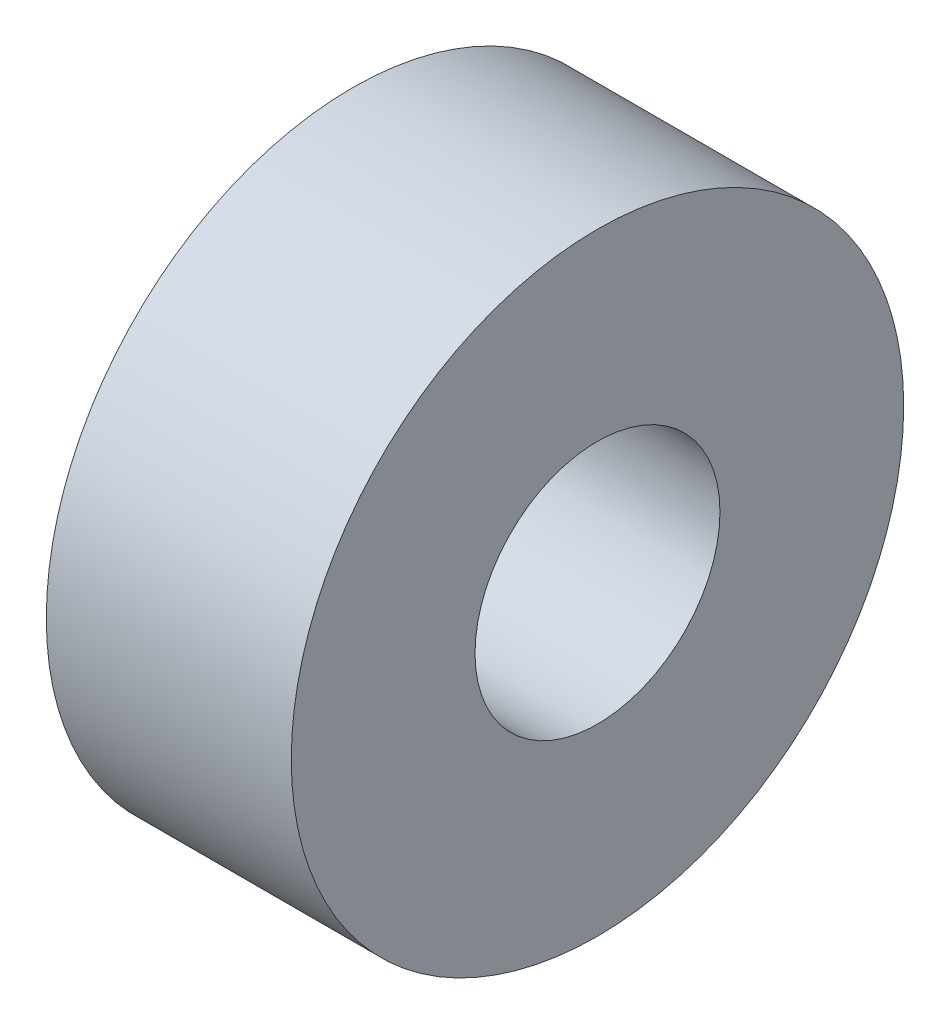
from build123d import *

# Parameters (mm, degrees)
SKETCH1_R           = 15.875
SKETCH1_R_2         = 6.35
BOSS_EXTRUDE1_DEPTH = 12.7


with BuildPart() as part:
    # Sketch1 → Boss-Extrude1 (new body)
    with BuildSketch(Plane(origin=(0, 0, 0), x_dir=(0, 0, -1), z_dir=(1, 0, 0))):
        Circle(SKETCH1_R)
        Circle(SKETCH1_R_2, mode=Mode.SUBTRACT)
    extrude(amount=BOSS_EXTRUDE1_DEPTH)


solid = part.part
